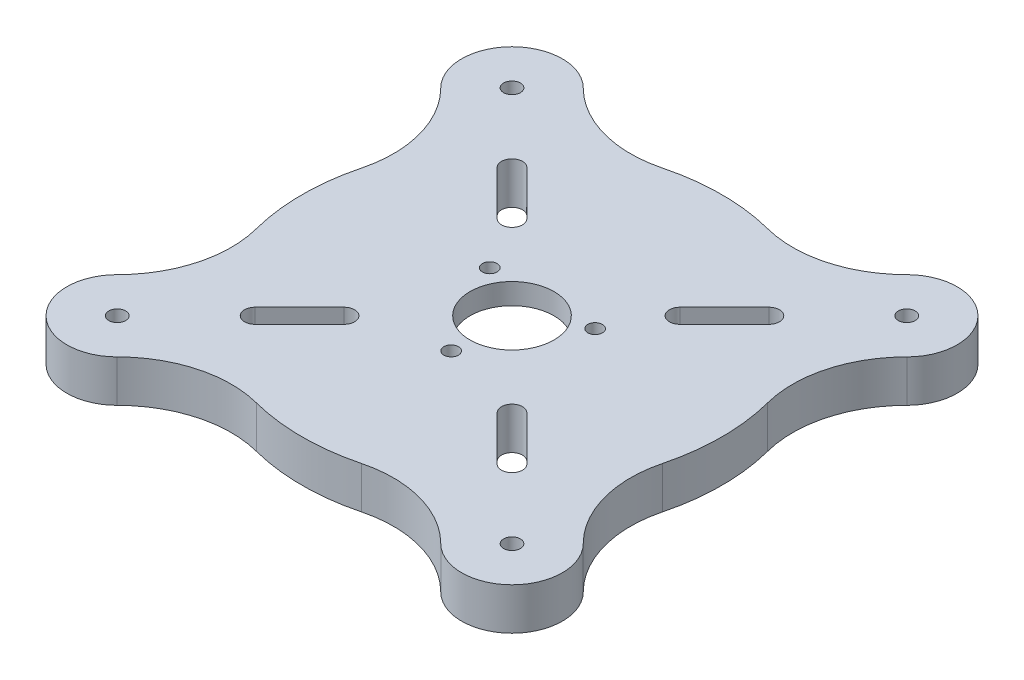
from build123d import *

# Parameters (mm, degrees)
SKETCH1_R           = 2
BOSS_EXTRUDE1_DEPTH = 10
SKETCH2_R           = 21.25
CUT_EXTRUDE1_DEPTH  = 5
SKETCH2_3_R         = 1.75
CUT_EXTRUDE2_DEPTH  = 85.067442245
SKETCH4_R           = 10
CUT_EXTRUDE3_DEPTH  = 84.620182047


with BuildPart() as part:
    # Sketch1 → Boss-Extrude1 (new body)
    with BuildSketch(Plane(origin=(0, 0, 0), x_dir=(1, 0, 0), z_dir=(0, 1, 0))):
        with BuildLine():
            ThreePointArc((48.409618097, -12.510350744), (50, 0), (48.409618097, 12.510350744))
            ThreePointArc((48.409618097, 12.510350744), (48.502831547, 26.466358431), (55.507882323, 38.537319575))
            ThreePointArc((55.507882323, 38.537319575), (55.507882323, 55.507882323), (38.537319575, 55.507882323))
            ThreePointArc((38.537319575, 55.507882323), (26.466358431, 48.502831547), (12.510350744, 48.409618097))
            ThreePointArc((12.510350744, 48.409618097), (0, 50), (-12.510350744, 48.409618097))
            ThreePointArc((-12.510350744, 48.409618097), (-26.466358431, 48.502831547), (-38.537319575, 55.507882323))
            ThreePointArc((-38.537319575, 55.507882323), (-55.507882323, 55.507882323), (-55.507882323, 38.537319575))
            ThreePointArc((-55.507882323, 38.537319575), (-48.502831547, 26.466358431), (-48.409618097, 12.510350744))
            ThreePointArc((-48.409618097, 12.510350744), (-50, 0), (-48.409618097, -12.510350744))
            ThreePointArc((-48.409618097, -12.510350744), (-48.502831547, -26.466358431), (-55.507882323, -38.537319575))
            ThreePointArc((-55.507882323, -38.537319575), (-55.507882323, -55.507882323), (-38.537319575, -55.507882323))
            ThreePointArc((-38.537319575, -55.507882323), (-26.466358431, -48.502831547), (-12.510350744, -48.409618097))
            ThreePointArc((-12.510350744, -48.409618097), (0, -50), (12.510350744, -48.409618097))
            ThreePointArc((12.510350744, -48.409618097), (26.466358431, -48.502831547), (38.537319575, -55.507882323))
            ThreePointArc((38.537319575, -55.507882323), (55.507882323, -55.507882323), (55.507882323, -38.537319575))
            ThreePointArc((55.507882323, -38.537319575), (48.502831547, -26.466358431), (48.409618097, -12.510350744))
        make_face()
        with BuildLine():
            ThreePointArc((-21.767766953, -18.232233047), (-18.232233047, -18.232233047), (-18.232233047, -21.767766953))
            Line((-18.232233047, -21.767766953), (-28.838834765, -32.374368671))
            ThreePointArc((-28.838834765, -32.374368671), (-32.374368671, -32.374368671), (-32.374368671, -28.838834765))
            Line((-32.374368671, -28.838834765), (-21.767766953, -18.232233047))
        make_face(mode=Mode.SUBTRACT)
        with BuildLine():
            ThreePointArc((18.232233047, -21.767766953), (18.232233047, -18.232233047), (21.767766953, -18.232233047))
            Line((21.767766953, -18.232233047), (32.374368671, -28.838834765))
            ThreePointArc((32.374368671, -28.838834765), (32.374368671, -32.374368671), (28.838834765, -32.374368671))
            Line((28.838834765, -32.374368671), (18.232233047, -21.767766953))
        make_face(mode=Mode.SUBTRACT)
        with BuildLine():
            ThreePointArc((-18.232233047, 21.767766953), (-18.232233047, 18.232233047), (-21.767766953, 18.232233047))
            Line((-21.767766953, 18.232233047), (-32.374368671, 28.838834765))
            ThreePointArc((-32.374368671, 28.838834765), (-32.374368671, 32.374368671), (-28.838834765, 32.374368671))
            Line((-28.838834765, 32.374368671), (-18.232233047, 21.767766953))
        make_face(mode=Mode.SUBTRACT)
        with BuildLine():
            ThreePointArc((21.767766953, 18.232233047), (18.232233047, 18.232233047), (18.232233047, 21.767766953))
            Line((18.232233047, 21.767766953), (28.838834765, 32.374368671))
            ThreePointArc((28.838834765, 32.374368671), (32.374368671, 32.374368671), (32.374368671, 28.838834765))
            Line((32.374368671, 28.838834765), (21.767766953, 18.232233047))
        make_face(mode=Mode.SUBTRACT)
        with Locations((47.022600949, -47.022600949)):
            Circle(SKETCH1_R, mode=Mode.SUBTRACT)
        with Locations((-47.022600949, -47.022600949)):
            Circle(SKETCH1_R, mode=Mode.SUBTRACT)
        with Locations((-47.022600949, 47.022600949)):
            Circle(SKETCH1_R, mode=Mode.SUBTRACT)
        with Locations((47.022600949, 47.022600949)):
            Circle(SKETCH1_R, mode=Mode.SUBTRACT)
    extrude(amount=BOSS_EXTRUDE1_DEPTH)

    # Sketch2 → Cut-Extrude1 (cut)
    with BuildSketch(Plane.XZ):
        Circle(SKETCH2_R)
    extrude(amount=-CUT_EXTRUDE1_DEPTH, mode=Mode.SUBTRACT)

    # Sketch2<3> → Cut-Extrude2 (cut, through all)
    with BuildSketch(Plane.XZ):
        with Locations((0, 14.5)):
            Circle(SKETCH2_3_R)
        with Locations((12.557368355, -7.25)):
            Circle(SKETCH2_3_R)
        with Locations((-12.557368355, -7.25)):
            Circle(SKETCH2_3_R)
    extrude(amount=-CUT_EXTRUDE2_DEPTH, mode=Mode.SUBTRACT)

    # Sketch4 → Cut-Extrude3 (cut, through all)
    with BuildSketch(Plane(origin=(0, 5, 0), x_dir=(-1, 0, 0), z_dir=(0, -1, 0))):
        Circle(SKETCH4_R)
    extrude(amount=-CUT_EXTRUDE3_DEPTH, mode=Mode.SUBTRACT)


solid = part.part
